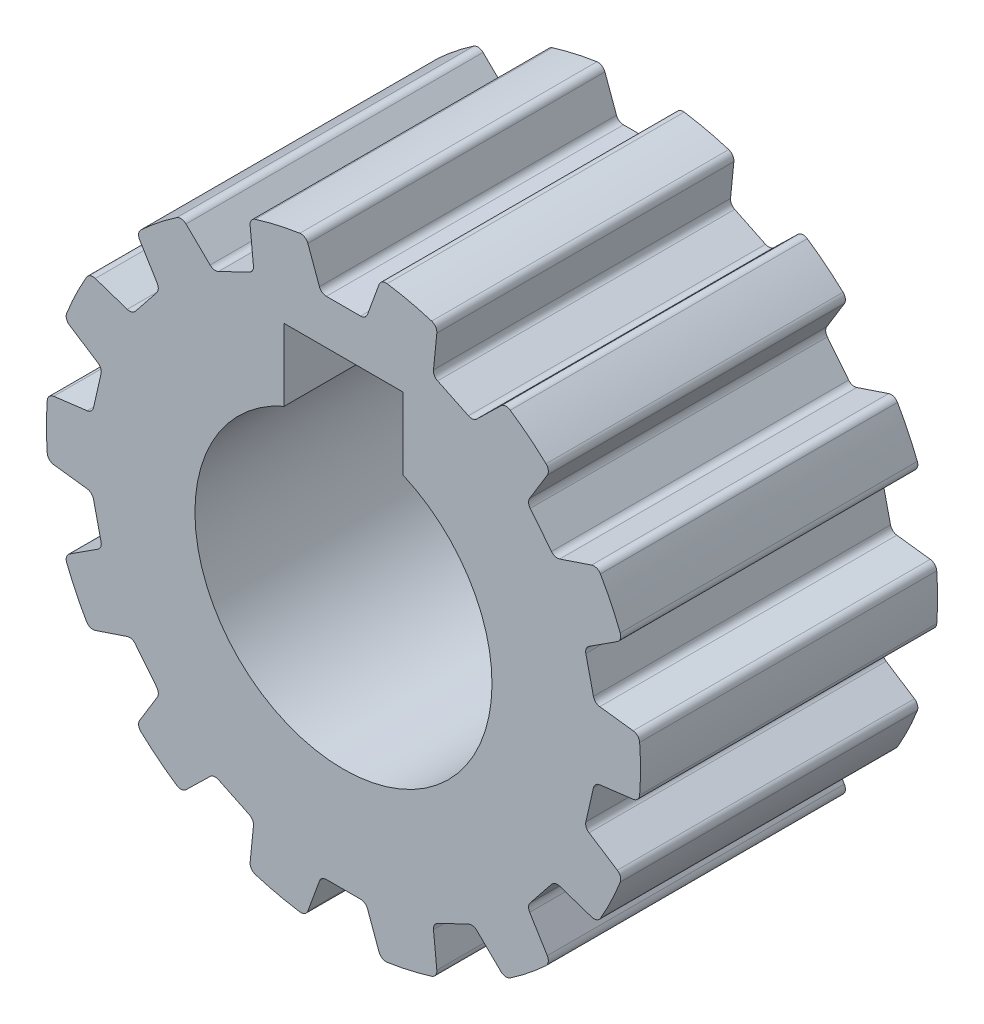
from build123d import *

# Parameters (mm, degrees)
SKETCH1_R           = 10
BOSS_EXTRUDE1_DEPTH = 5
CUT_EXTRUDE1_DEPTH  = 18.320508076
CIRPATTERN1_COUNT   = 14
FILLET1_R           = 0.25


with BuildPart() as part:
    # Sketch1 → Boss-Extrude1 (new, symmetric)
    with BuildSketch(Plane.XY):
        Circle(SKETCH1_R)
        with BuildLine():
            Line((-1.994108677, 7), (2.005891323, 7))
            Line((2.005891323, 7), (2.005891323, 4.58))
            ThreePointArc((2.005891323, 4.58), (-0.006427961, -4.999995868), (-1.994108677, 4.585142373))
            Line((-1.994108677, 4.585142373), (-1.994108677, 7))
        make_face(mode=Mode.SUBTRACT)
    extrude(amount=BOSS_EXTRUDE1_DEPTH, both=True)

    # Sketch2 → Cut-Extrude1 (cut, through all)
    with BuildSketch(Plane.XY.offset(5)):
        with BuildLine():
            Line((-0.75, 8.5), (0.75, 8.5))
            Line((0.75, 8.5), (1.266640021, 9.919456792))
            ThreePointArc((1.266640021, 9.919456792), (0, 10.615950068), (-1.266640021, 9.919456792))
            Line((-1.266640021, 9.919456792), (-0.75, 8.5))
        make_face()
    cut_extrude1 = extrude(amount=-CUT_EXTRUDE1_DEPTH, mode=Mode.SUBTRACT)

    # CirPattern1: Cut-Extrude1 ×14 about axis
    cirpattern1_axis = Axis((0, 0, 0), (0, 0, 1))
    for i in range(1, CIRPATTERN1_COUNT):
        add(cut_extrude1.rotate(cirpattern1_axis, i * 360 / CIRPATTERN1_COUNT), mode=Mode.SUBTRACT)

    # Fillet1
    fillet1_edges = [part.edges().sort_by_distance(p)[0] for p in [
        (-8.545080745, 5.194381104, 0),
        (-6.965606473, 7.174979196, 0),
        (-6.17795025, 5.886036928, 0),
        (-7.113184952, 4.713289704, 0),
        (-9.952609221, 0.972404078, 0),
        (-9.38890138, 3.442169501, 0),
        (-8.119996553, 2.622623873, 0),
        (-8.453777954, 1.160232004, 0),
        (-9.38890138, -3.442169501, 0),
        (-9.952609221, -0.972404078, 0),
        (-8.453777954, -1.160232004, 0),
        (-8.119996553, -2.622623873, 0),
        (-6.965606473, -7.174979196, 0),
        (-8.545080745, -5.194381104, 0),
        (-7.113184952, -4.713289704, 0),
        (-6.17795025, -5.886036928, 0),
        (-3.162687777, -9.486696265, 0),
        (-5.445094229, -8.387547248, 0),
        (-4.363738433, -7.332822573, 0),
        (-3.012285132, -7.983648182, 0),
        (1.266640021, -9.919456792, 0),
        (-1.266640021, -9.919456792, 0),
        (-0.75, -8.5, 0),
        (0.75, -8.5, 0),
        (5.445094229, -8.387547248, 0),
        (3.162687777, -9.486696265, 0),
        (3.012285132, -7.983648182, 0),
        (4.363738433, -7.332822573, 0),
        (8.545080745, -5.194381104, 0),
        (6.965606473, -7.174979196, 0),
        (6.17795025, -5.886036928, 0),
        (7.113184952, -4.713289704, 0),
        (9.952609221, -0.972404078, 0),
        (9.38890138, -3.442169501, 0),
        (8.119996553, -2.622623873, 0),
        (8.453777954, -1.160232004, 0),
        (9.38890138, 3.442169501, 0),
        (9.952609221, 0.972404078, 0),
        (8.453777954, 1.160232004, 0),
        (8.119996553, 2.622623873, 0),
        (6.965606473, 7.174979196, 0),
        (8.545080745, 5.194381104, 0),
        (7.113184952, 4.713289704, 0),
        (6.17795025, 5.886036928, 0),
        (3.162687777, 9.486696265, 0),
        (5.445094229, 8.387547248, 0),
        (4.363738433, 7.332822573, 0),
        (3.012285132, 7.983648182, 0),
        (-5.445094229, 8.387547248, 0),
        (-3.162687777, 9.486696265, 0),
        (-3.012285132, 7.983648182, 0),
        (-4.363738433, 7.332822573, 0),
        (1.266640021, 9.919456792, 0),
        (0.75, 8.5, 0),
        (-0.75, 8.5, 0),
        (-1.266640021, 9.919456792, 0),
    ]]
    fillet(fillet1_edges, radius=FILLET1_R)


solid = part.part
